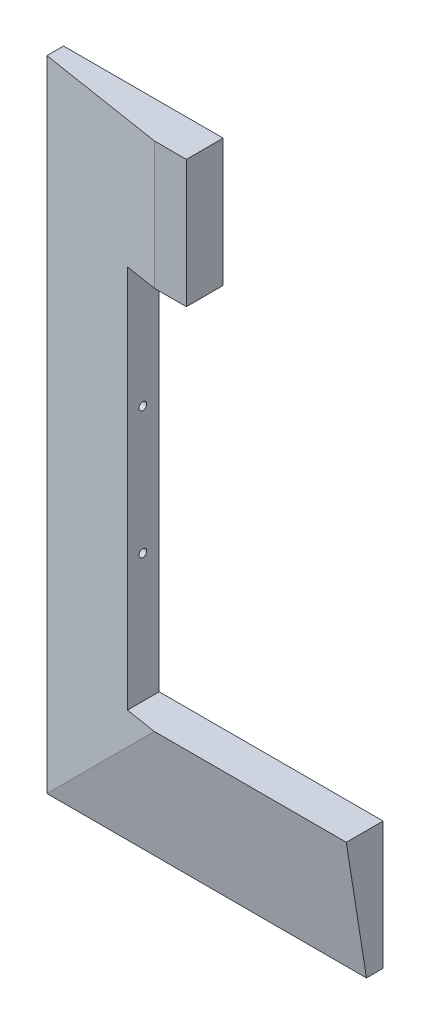
from build123d import *

# Parameters (mm, degrees)
DODANIE_WYCI_GNI_CIE1_DEPTH = 5.2
SZKIC6_W                    = 49.271239353
SZKIC6_H                    = 120
WYTNIJ_WYCI_GNI_CIE1_DEPTH  = 78
WYTNIJ_WYCI_GNI_CIE2_DEPTH  = 5.6
SZKIC9_R                    = 2.424871131
SZKIC9_R_2                  = 1.2
DODANIE_WYCI_GNI_CIE3_DEPTH = 3.8
SZKIC10_W                   = 50
SZKIC10_H                   = 39.9
WYTNIJ_WYCI_GNI_CIE4_DEPTH  = 24


with BuildPart() as part:
    # Szkic2 → Dodanie-wyciągnięcie1 (new body)
    with BuildSketch(Plane.XY):
        Polygon((18.542832418, 83.245366469), (18.542832418, 43.345366469), (-51.457167582, 43.345366469), (-51.457167582, -76.654633531), (18.542832418, -76.654633531), (18.542832418, -116.554633531), (-81.357167582, -116.554633531), (-81.357167582, 83.245366469), align=None)
    extrude(amount=DODANIE_WYCI_GNI_CIE1_DEPTH)

    # Szkic3 → Wyciągnięcie po profilach3 section 0
    with BuildSketch(Plane.XY.offset(11.5)):
        with BuildLine():
            Line((-41.457167582, -76.654633531), (18.542832418, -76.654633531))
            Line((18.542832418, -76.654633531), (18.542832418, 83.245366469))
            Line((18.542832418, 83.245366469), (-41.457167582, 83.245366469))
            Line((-41.457167582, 83.245366469), (-41.457167582, -76.654633531))
        make_face()
    # Szkic5 → Wyciągnięcie po profilach3 section 1
    with BuildSketch(Plane.XY.offset(5.2)):
        with BuildLine():
            Line((-81.357167582, 83.245366469), (18.542832418, 83.245366469))
            Line((18.542832418, 83.245366469), (18.542832418, -116.554633531))
            Line((18.542832418, -116.554633531), (-81.357167582, -116.554633531))
            Line((-81.357167582, -116.554633531), (-81.357167582, 83.245366469))
        make_face()
    loft()

    # Szkic6 → Wytnij-wyciągnięcie1 (cut)
    with BuildSketch(Plane(origin=(-51.457167582, 0, 0), x_dir=(0, 0, -1), z_dir=(1, 0, 0))):
        with Locations((-24.635619677, -16.654633531)):
            Rectangle(SZKIC6_W, SZKIC6_H)
    extrude(amount=WYTNIJ_WYCI_GNI_CIE1_DEPTH, mode=Mode.SUBTRACT)

    # Szkic7 → Wytnij-wyciągnięcie2 (cut)
    with BuildSketch(Plane(origin=(-51.457167582, 0, 0), x_dir=(0, 0, -1), z_dir=(1, 0, 0))):
        Polygon((-5.12, -34.1297624), (-7.22, -35.342197966), (-7.22, -37.767069096), (-5.12, -38.979504662), (-3.02, -37.767069096), (-3.02, -35.342197966), align=None)
        Polygon((-5.12, 5.6702376), (-7.22, 4.457802034), (-7.22, 2.032930904), (-5.12, 0.820495338), (-3.02, 2.032930904), (-3.02, 4.457802034), align=None)
    extrude(amount=-WYTNIJ_WYCI_GNI_CIE2_DEPTH, mode=Mode.SUBTRACT)

    # Szkic9 → Dodanie-wyciągnięcie3 (add)
    # profile 1 of 2: a face of its own
    with BuildSketch(Plane(origin=(-51.457167582, 0, 0), x_dir=(0, 0, -1), z_dir=(1, 0, 0))):
        with Locations((-5.12, 3.245366469)):
            Circle(SZKIC9_R)
        with Locations((-5.12, 3.245366469)):
            Circle(SZKIC9_R_2, mode=Mode.SUBTRACT)
    # profile 2 of 2: a face of its own
    with BuildSketch(Plane(origin=(-51.457167582, 0, 0), x_dir=(0, 0, -1), z_dir=(1, 0, 0))):
        with Locations((-5.12, -36.554633531)):
            Circle(SZKIC9_R)
        with Locations((-5.12, -36.554633531)):
            Circle(SZKIC9_R_2, mode=Mode.SUBTRACT)
    extrude(amount=-DODANIE_WYCI_GNI_CIE3_DEPTH)

    # Szkic10 → Wytnij-wyciągnięcie4 (cut)
    with BuildSketch(Plane.XY.offset(11.5)):
        with Locations((-6.457167582, 63.295366469)):
            Rectangle(SZKIC10_W, SZKIC10_H)
    extrude(amount=-WYTNIJ_WYCI_GNI_CIE4_DEPTH, mode=Mode.SUBTRACT)


solid = part.part
